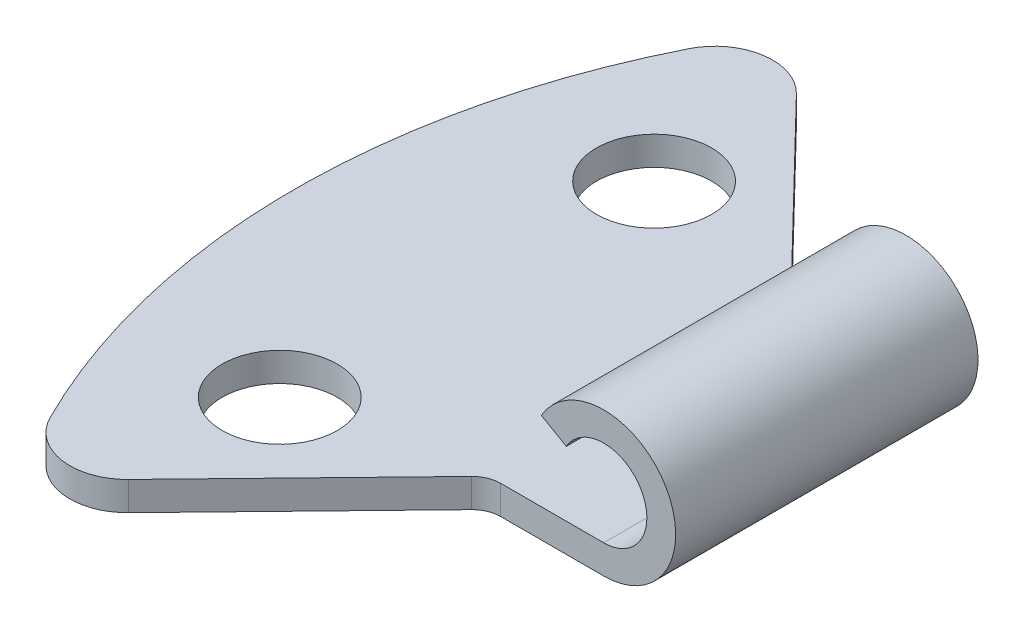
from build123d import *

# Parameters (mm, degrees)
ESTRUSIONE_ESTRUSIONE1_DEPTH  = 27
TAGLIO_ESTRUSIONE1_DEPTH      = 27
TAGLIO_ESTRUSIONE1_DEPTH_BACK = 27
SCHIZZO2_R                    = 2


with BuildPart() as part:
    # Schizzo1 → Estrusione-Estrusione1 (new body)
    with BuildSketch(Plane.XY):
        with BuildLine():
            Line((-8, 1), (8, 1))
            ThreePointArc((8, 1), (9.299038106, 3.25), (6.700961894, 3.25))
            Line((6.700961894, 3.25), (5.834936491, 3.75))
            ThreePointArc((5.834936491, 3.75), (10.165063509, 3.75), (8, 0))
            Line((8, 0), (-8, 0))
            Line((-8, 0), (-8, 1))
        make_face()
    extrude(amount=ESTRUSIONE_ESTRUSIONE1_DEPTH)

    # Schizzo2 → Taglio-Estrusione1 (cut, two sides: drawn at the far end of the back side and taken through both)
    with BuildSketch(Plane(origin=(0, 1, 0), x_dir=(1, 0, 0), z_dir=(0, 1, 0)).offset(-TAGLIO_ESTRUSIONE1_DEPTH_BACK)):
        with BuildLine():
            Line((12, -8.25), (12, 0))
            Line((12, 0), (-8, 0))
            Line((-8, 0), (-8, -13.5))
            ThreePointArc((-8, -13.5), (-7.335119746, -7.798152768), (-5.37615642, -2.402266344))
            ThreePointArc((-5.37615642, -2.402266344), (-3.892408367, -1.321236694), (-2.152116023, -1.905630351))
            Line((-2.152116023, -1.905630351), (3.705353538, -7.946145836))
            ThreePointArc((3.705353538, -7.946145836), (4.033475684, -8.170908746), (4.423253931, -8.25))
            Line((4.423253931, -8.25), (12, -8.25))
        make_face()
        with BuildLine():
            Line((-8, -27), (12, -27))
            Line((12, -27), (12, -18.75))
            Line((12, -18.75), (4.423253931, -18.75))
            ThreePointArc((4.423253931, -18.75), (4.033475684, -18.829091254), (3.705353538, -19.053854164))
            Line((3.705353538, -19.053854164), (-2.152116023, -25.094369649))
            ThreePointArc((-2.152116023, -25.094369649), (-3.892408367, -25.678763306), (-5.37615642, -24.597733656))
            ThreePointArc((-5.37615642, -24.597733656), (-7.335119746, -19.201847232), (-8, -13.5))
            Line((-8, -13.5), (-8, -27))
        make_face()
        with Locations((-2, -7)):
            Circle(SCHIZZO2_R)
        with Locations((-2, -20)):
            Circle(SCHIZZO2_R)
    extrude(amount=TAGLIO_ESTRUSIONE1_DEPTH + TAGLIO_ESTRUSIONE1_DEPTH_BACK, mode=Mode.SUBTRACT)


solid = part.part
